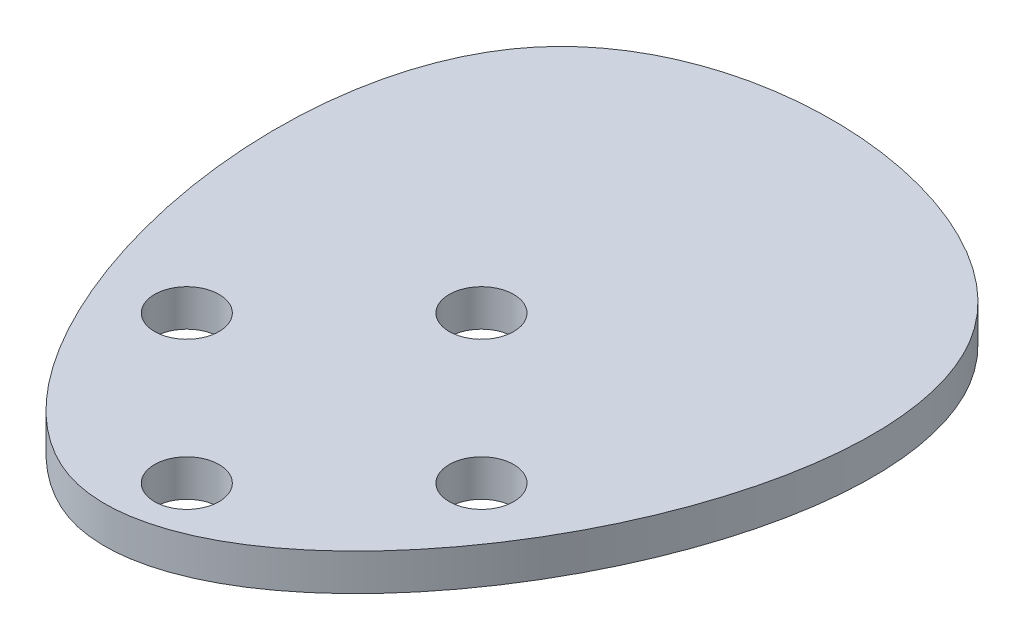
from build123d import *

# Parameters (mm, degrees)
EXTRUDE1_DEPTH     = 2
SKETCH2_R          = 1.75
CUT_EXTRUDE1_DEPTH = 32.286571323


with BuildPart() as part:
    # Sketch1 → Extrude1 (new body)
    with BuildSketch(Plane(origin=(0, 0, 0), x_dir=(1, 0, 0), z_dir=(0, 1, 0))):
        with BuildLine():
            add(Edge.make_bspline(
                [(0, -11.1), (10.440972459, -9.480441053), (28.806750546, 25.910018574), (-23.170226362, 30.565808695), (-11.4801118, -10.989728695), (-1.045496555, -11.26217295), (0, -11.1)],
                knots=[0, 0, 0, 0, 0.366728933, 0.632779573, 0.963277957, 1, 1, 1, 1], degree=3))
        make_face()
    extrude(amount=EXTRUDE1_DEPTH)

    # Sketch2 → Cut-Extrude1 (cut, through all)
    with BuildSketch(Plane(origin=(0, 2, 0), x_dir=(1, 0, 0), z_dir=(0, 1, 0))):
        with Locations(Location((0, 8, 0), (0, 0, 270))):
            Circle(SKETCH2_R)
        with Locations(Location((8, 0, 0), (0, 0, 270))):
            Circle(SKETCH2_R)
        with Locations(Location((0, -8, 0), (0, 0, 270))):
            Circle(SKETCH2_R)
        with Locations(Location((-8, 0, 0), (0, 0, 270))):
            Circle(SKETCH2_R)
    extrude(amount=-CUT_EXTRUDE1_DEPTH, mode=Mode.SUBTRACT)


solid = part.part
